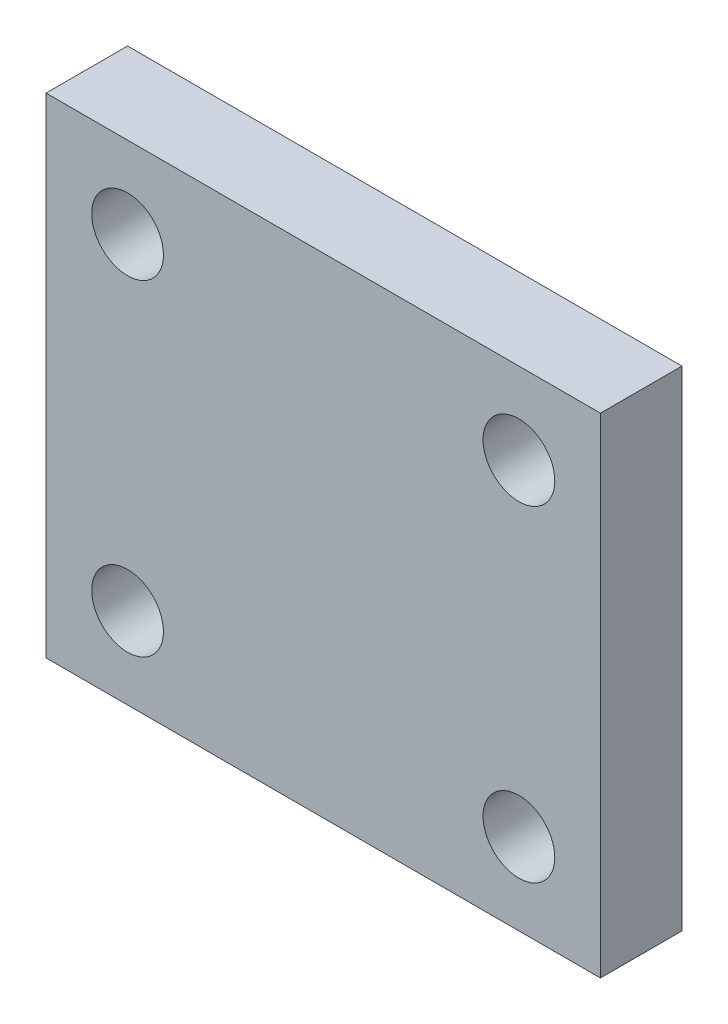
from build123d import *

# Parameters (mm, degrees)
SKETCH_2_W      = 34
SKETCH_2_H      = 30
EXTRUDE_1_DEPTH = 5
HOLE_WIZARD_1_D = 4.4


with BuildPart() as part:
    # 草图2 → 凸台-拉伸1 (new body)
    with BuildSketch(Plane.XY):
        Rectangle(SKETCH_2_W, SKETCH_2_H)
    extrude(amount=EXTRUDE_1_DEPTH)

    # 孔1 (through all)
    with Locations(Plane.XY.offset(5)):
        with Locations((-12, 10), (12, 10), (12, -10), (-12, -10)):
            Hole(HOLE_WIZARD_1_D / 2)


solid = part.part
